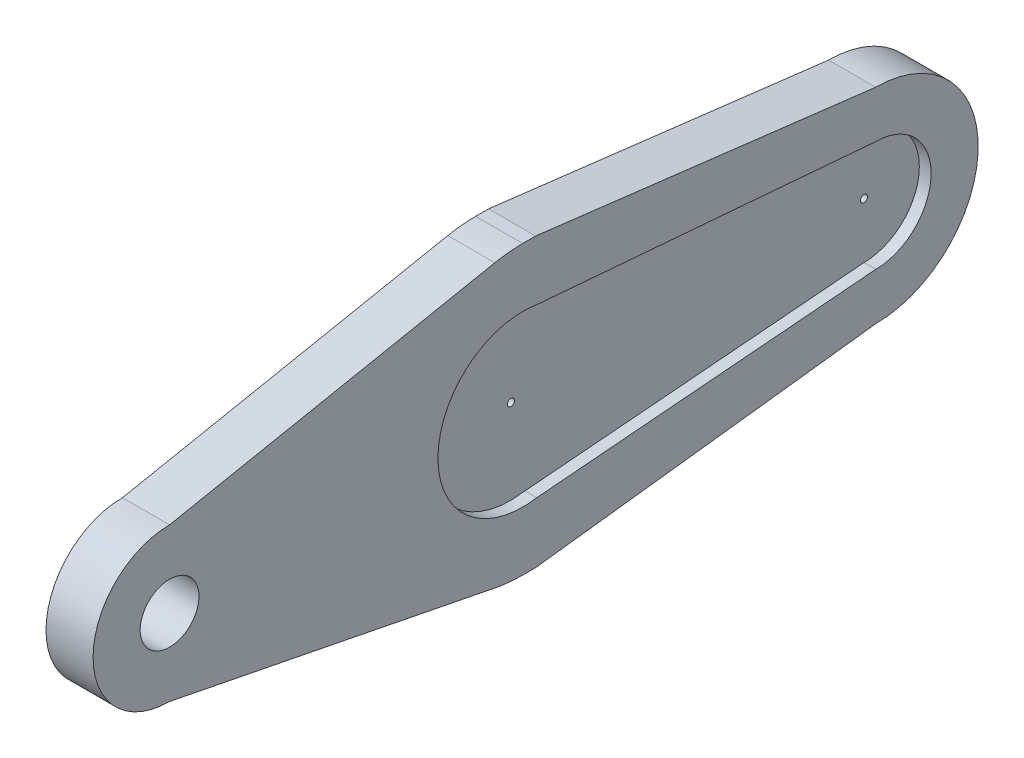
from build123d import *

# Parameters (mm, degrees)
SKETCH2_R           = 1.25
BOSS_EXTRUDE1_DEPTH = 2
BOSS_EXTRUDE2_DEPTH = 1.5
SKETCH3_R           = 0.15
CUT_EXTRUDE1_DEPTH  = 0.5


with BuildPart() as part:
    # Sketch2 → Boss-Extrude1 (new body)
    with BuildSketch(Plane.YZ):
        with BuildLine():
            ThreePointArc((-4.35, -14.45), (-3.075914484, -17.525914513), (4.1e-08, -18.8))
            ThreePointArc((4.1e-08, -18.8), (3.075914513, -17.525914484), (4.35, -14.45))
            Line((4.35, -14.45), (6.1, 0))
            Line((6.1, 0), (6.1, 0.55))
            ThreePointArc((6.1, 0.55), (6.070921356, 1.144906627), (5.983962658, 1.734141424))
            Line((5.983962658, 1.734141424), (3.25, 15.55))
            ThreePointArc((3.25, 15.55), (2.298097039, 17.848097039), (0, 18.8))
            ThreePointArc((0, 18.8), (-2.298097039, 17.848097039), (-3.25, 15.55))
            Line((-3.25, 15.55), (-5.983962658, 1.734141424))
            ThreePointArc((-5.983962658, 1.734141424), (-6.070921356, 1.144906627), (-6.1, 0.55))
            Line((-6.1, 0.55), (-6.1, 0))
            Line((-6.1, 0), (-4.35, -14.45))
        make_face()
        with BuildLine():
            Line((3.550344828, -0.045862069), (2.35, -14.45))
            ThreePointArc((2.35, -14.45), (0, -16.8), (-2.35, -14.45))
            Line((-2.35, -14.45), (-3.550344828, -0.045862069))
            ThreePointArc((-3.550344828, -0.045862069), (-3.58756473, 0.251036273), (-3.6, 0.55))
            ThreePointArc((-3.6, 0.55), (0, 4.15), (3.6, 0.55))
            ThreePointArc((3.6, 0.55), (3.58756473, 0.251036273), (3.550344828, -0.045862069))
        make_face(mode=Mode.SUBTRACT)
        with Locations((0, 15.55)):
            Circle(SKETCH2_R, mode=Mode.SUBTRACT)
    extrude(amount=BOSS_EXTRUDE1_DEPTH)

    # Sketch2<3> → Boss-Extrude2 (add)
    with BuildSketch(Plane.YZ):
        with BuildLine():
            ThreePointArc((-2.35, -14.45), (0, -16.8), (2.35, -14.45))
            Line((2.35, -14.45), (3.550344828, -0.045862069))
            Line((3.550344828, -0.045862069), (3.6, 0.55))
            ThreePointArc((3.6, 0.55), (0, 4.15), (-3.6, 0.55))
            Line((-3.6, 0.55), (-3.550344828, -0.045862069))
            Line((-3.550344828, -0.045862069), (-2.35, -14.45))
        make_face()
    extrude(amount=BOSS_EXTRUDE2_DEPTH)

    # Sketch3 → Cut-Extrude1 (cut)
    with BuildSketch(Plane.YZ.offset(1.5)):
        with Locations((0, 0.55)):
            Circle(SKETCH3_R)
        with Locations((0, -14.45)):
            Circle(SKETCH3_R)
    extrude(amount=-CUT_EXTRUDE1_DEPTH, mode=Mode.SUBTRACT)


solid = part.part
